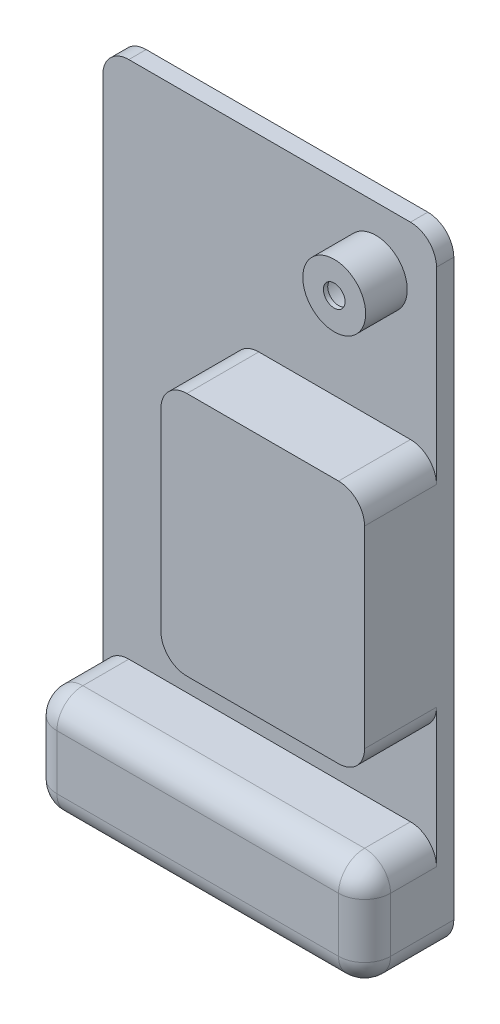
from build123d import *

# Parameters (mm, degrees)
SKIZZE2_W                       = 144.44
SKIZZE2_H                       = 77
AUFSATZ_LINEAR_AUSTRAGEN1_DEPTH = 4
SKIZZE4_W                       = 77
SKIZZE4_H                       = 24.6
AUFSATZ_LINEAR_AUSTRAGEN2_DEPTH = 16.6
VERRUNDUNG2_R                   = 6
SKIZZE5_W                       = 47
SKIZZE5_H                       = 56.5
AUFSATZ_LINEAR_AUSTRAGEN3_DEPTH = 16.6
VERRUNDUNG4_R                   = 6
SKIZZE7_R                       = 7.25
AUFSATZ_LINEAR_AUSTRAGEN5_DEPTH = 9.6
VERRUNDUNG5_R                   = 6
VERRUNDUNG7_R                   = 6
WANDUNG2_T                      = -1
SKIZZE8_R                       = 2.5
SCHNITT_LINEAR_AUSTRAGEN1_DEPTH = 83.963476301


with BuildPart() as part:
    # Skizze2 → Aufsatz-Linear austragen1 (new body)
    with BuildSketch(Plane(origin=(0, 0, 0), x_dir=(0, 1, 0), z_dir=(0, 0, 1))):
        Rectangle(SKIZZE2_W, SKIZZE2_H)
    extrude(amount=AUFSATZ_LINEAR_AUSTRAGEN1_DEPTH)

    # Skizze4 → Aufsatz-Linear austragen2 (add)
    with BuildSketch(Plane.XY.offset(4)):
        with Locations((0, -59.92)):
            Rectangle(SKIZZE4_W, SKIZZE4_H)
    extrude(amount=AUFSATZ_LINEAR_AUSTRAGEN2_DEPTH)

    # Verrundung2
    verrundung2_edges = [part.edges().sort_by_distance(p)[0] for p in [
        (38.5, 72.22, 2),
        (38.5, -72.22, 10.3),
        (-38.5, -72.22, 10.3),
        (-38.5, 72.22, 2),
    ]]
    fillet(verrundung2_edges, radius=VERRUNDUNG2_R)

    # Skizze5 → Aufsatz-Linear austragen3 (add)
    with BuildSketch(Plane.XY.offset(4)):
        with Locations((15, 0.53)):
            Rectangle(SKIZZE5_W, SKIZZE5_H)
    extrude(amount=AUFSATZ_LINEAR_AUSTRAGEN3_DEPTH)

    # Verrundung4
    verrundung4_edges = [part.edges().sort_by_distance(p)[0] for p in [
        (38.5, -27.72, 12.3),
        (38.5, 28.78, 12.3),
        (-8.5, 28.78, 12.3),
        (-8.5, -27.72, 12.3),
    ]]
    fillet(verrundung4_edges, radius=VERRUNDUNG4_R)

    # Skizze7 → Aufsatz-Linear austragen5 (add)
    with BuildSketch(Plane.XY.offset(4)):
        with Locations(Location((24.503110224, 58.349132978, 0), (0, 0, 180))):
            Circle(SKIZZE7_R)
    extrude(amount=AUFSATZ_LINEAR_AUSTRAGEN5_DEPTH)

    # Verrundung5
    verrundung5_edges = [part.edges().sort_by_distance(p)[0] for p in [
        (0, -47.62, 20.6),
    ]]
    fillet(verrundung5_edges, radius=VERRUNDUNG5_R)

    # Verrundung7
    verrundung7_edges = [part.edges().sort_by_distance(p)[0] for p in [
        (-38.5, -59.92, 20.6),
        (-38.5, -47.62, 9.3),
        (-38.5, -49.377359313, 18.842640687),
        (38.5, -47.62, 9.3),
        (38.5, -49.377359313, 18.842640687),
        (38.5, -59.92, 20.6),
        (0, -72.22, 20.6),
        (-36.742640687, -70.462640687, 20.6),
        (36.742640687, -70.462640687, 20.6),
    ]]
    fillet(verrundung7_edges, radius=VERRUNDUNG7_R)

    # Wandung2
    wandung2_openings = [part.faces().sort_by_distance(p)[0] for p in [
        (0, 0, 0),
    ]]
    offset(amount=WANDUNG2_T, openings=wandung2_openings, kind=Kind.INTERSECTION)

    # Skizze8 → Schnitt-Linear austragen1 (cut, through all)
    with BuildSketch(Plane.XY.offset(13.6)):
        with Locations((24.503110224, 58.349132978)):
            Circle(SKIZZE8_R)
    extrude(amount=-SCHNITT_LINEAR_AUSTRAGEN1_DEPTH, mode=Mode.SUBTRACT)


solid = part.part
